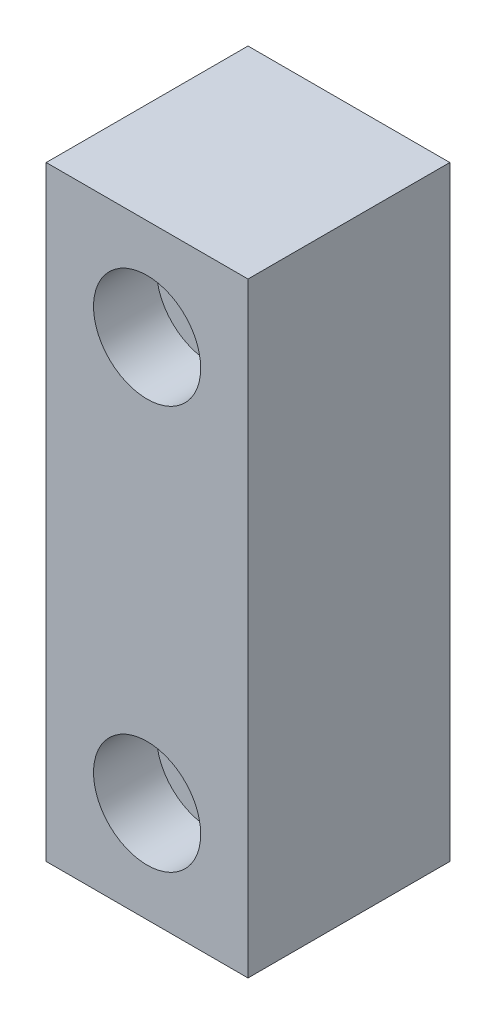
from build123d import *

# Parameters (mm, degrees)
SKETCH1_W           = 76.2
SKETCH1_H           = 25.4
BOSS_EXTRUDE1_DEPTH = 12.7
CUT_EXTRUDE2_START  = 12.7
SKETCH2_R           = 4.3688
CUT_EXTRUDE2_DEPTH  = 76.2
CUT_EXTRUDE4_START  = 12.7
SKETCH3_R           = 6.7437
CUT_EXTRUDE4_DEPTH  = 7.9248
CUT_EXTRUDE6_START  = 12.7
SKETCH4_R           = 4.3688
CUT_EXTRUDE6_DEPTH  = 76.2
CUT_EXTRUDE8_START  = 12.7
SKETCH5_R           = 6.7437
CUT_EXTRUDE8_DEPTH  = 7.9248


with BuildPart() as part:
    # Sketch1 → Boss-Extrude1 (new, symmetric)
    with BuildSketch(Plane(origin=(0, 0, 0), x_dir=(0, 1, 0), z_dir=(0, 0, 1))):
        Rectangle(SKETCH1_W, SKETCH1_H)
    extrude(amount=BOSS_EXTRUDE1_DEPTH, both=True)

    # Sketch2 → Cut-Extrude2 (cut)
    with BuildSketch(Plane(origin=(0, 0, 0), x_dir=(0, 1, 0), z_dir=(0, 0, 1)).offset(CUT_EXTRUDE2_START)):
        with Locations(Location((-25.4, 0, 0), (0, 0, 270))):
            Circle(SKETCH2_R)
    extrude(amount=-CUT_EXTRUDE2_DEPTH, mode=Mode.SUBTRACT)

    # Sketch3 → Cut-Extrude4 (cut)
    with BuildSketch(Plane(origin=(0, 0, 0), x_dir=(0, 1, 0), z_dir=(0, 0, 1)).offset(CUT_EXTRUDE4_START)):
        with Locations(Location((-25.4, 0, 0), (0, 0, 270))):
            Circle(SKETCH3_R)
    extrude(amount=-CUT_EXTRUDE4_DEPTH, mode=Mode.SUBTRACT)

    # Sketch4 → Cut-Extrude6 (cut)
    with BuildSketch(Plane(origin=(0, 0, 0), x_dir=(0, 1, 0), z_dir=(0, 0, 1)).offset(CUT_EXTRUDE6_START)):
        with Locations(Location((25.4, 0, 0), (0, 0, 270))):
            Circle(SKETCH4_R)
    extrude(amount=-CUT_EXTRUDE6_DEPTH, mode=Mode.SUBTRACT)

    # Sketch5 → Cut-Extrude8 (cut)
    with BuildSketch(Plane(origin=(0, 0, 0), x_dir=(0, 1, 0), z_dir=(0, 0, 1)).offset(CUT_EXTRUDE8_START)):
        with Locations(Location((25.4, 0, 0), (0, 0, 270))):
            Circle(SKETCH5_R)
    extrude(amount=-CUT_EXTRUDE8_DEPTH, mode=Mode.SUBTRACT)


solid = part.part
